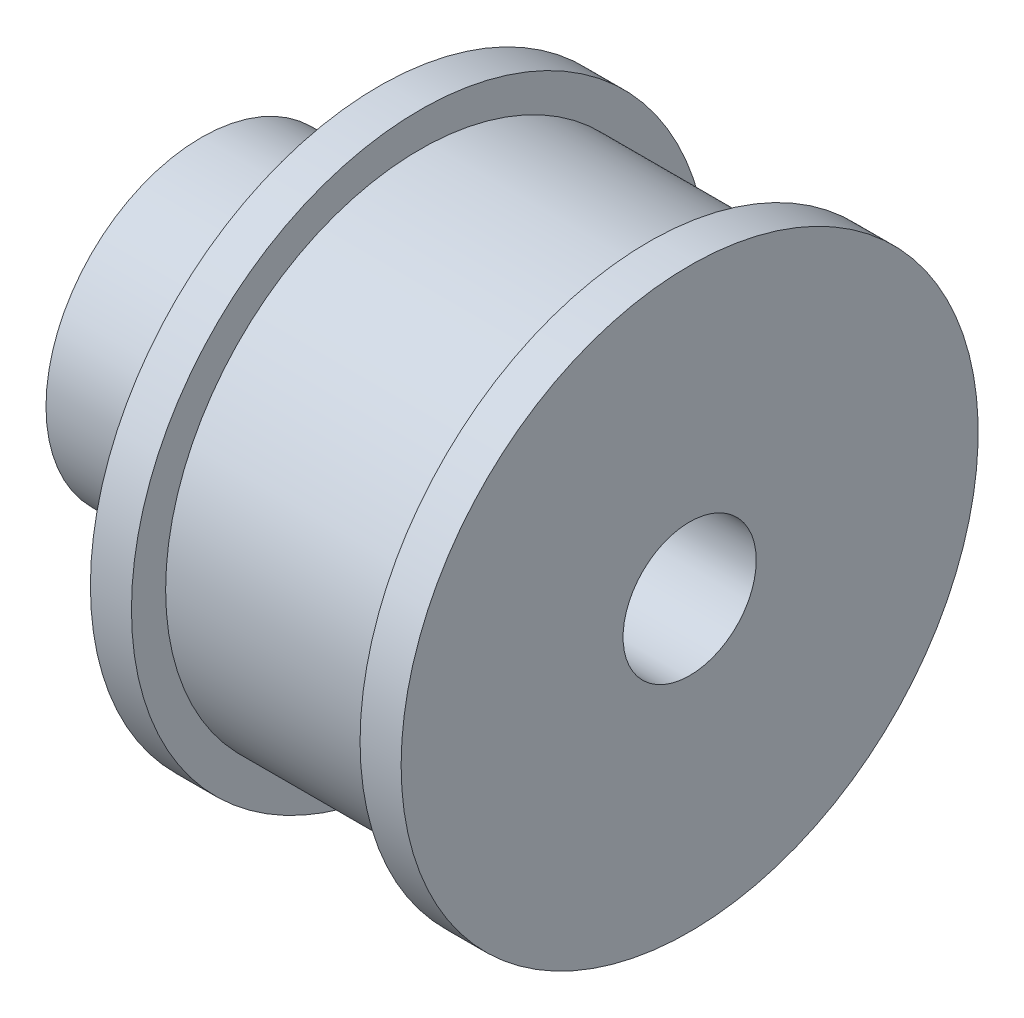
from build123d import *

# Parameters (mm, degrees)
F_6_0_6_DIAMETER_HOLE2_D     = 6
F_6_0_6_DIAMETER_HOLE2_DEPTH = 24
F_6_0_6_DIAMETER_HOLE2_TIP   = 1.802581857


with BuildPart() as part:
    # Sketch1 → Revolve1 (revolve)
    with BuildSketch(Plane(origin=(0, 0, 0), x_dir=(1, 0, 0), z_dir=(0, 1, 0))):
        Polygon((0, -11.46), (-5.15, -11.46), (-5.15, -13), (-7, -13), (-7, -7), (-15, -7), (-15, 0), (-7, 0), (7, 0), (7, -13), (5.15, -13), (5.15, -11.46), align=None)
    revolve(axis=Axis((-7, 0, 0), (1, 0, 0)))

    # Ø6.0 (6) Diameter Hole2
    with Locations(Plane(origin=(7, 0, 0), x_dir=(0, 0, -1), z_dir=(1, 0, 0))):
        with Locations((0, 0)):
            Hole(F_6_0_6_DIAMETER_HOLE2_D / 2, depth=F_6_0_6_DIAMETER_HOLE2_DEPTH)
            with Locations((0, 0, -(F_6_0_6_DIAMETER_HOLE2_DEPTH + F_6_0_6_DIAMETER_HOLE2_TIP / 2))):  # 118° drill point
                Cone(0, F_6_0_6_DIAMETER_HOLE2_D / 2, F_6_0_6_DIAMETER_HOLE2_TIP, mode=Mode.SUBTRACT)


solid = part.part
